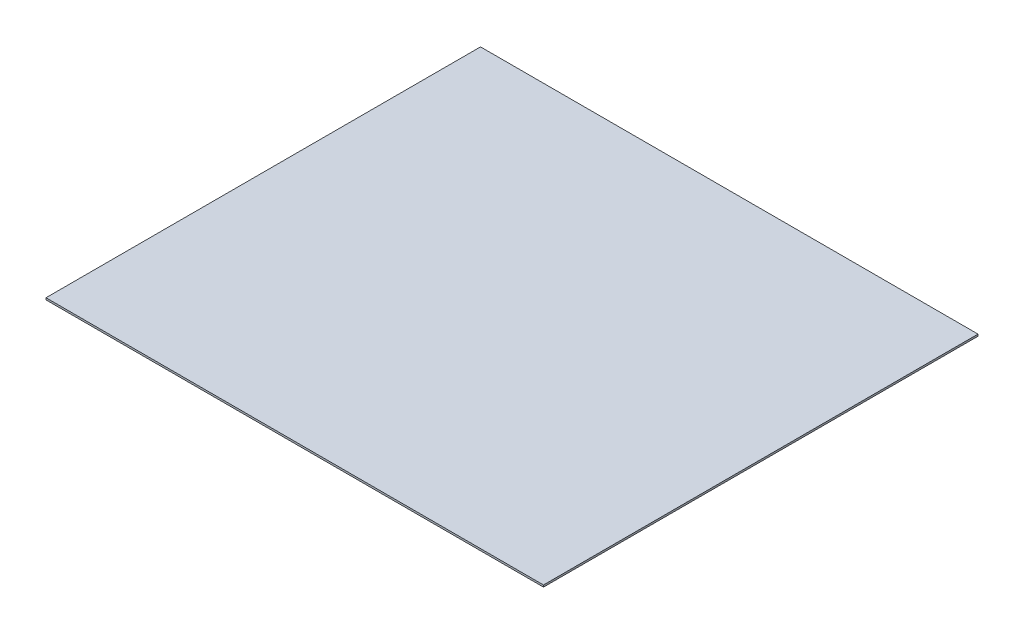
from build123d import *

# Parameters (mm, degrees)
SKETCH1_W           = 790
SKETCH1_H           = 690
BOSS_EXTRUDE1_DEPTH = 3


with BuildPart() as part:
    # Sketch1 → Boss-Extrude1 (new body)
    with BuildSketch(Plane(origin=(0, 0, 0), x_dir=(1, 0, 0), z_dir=(0, 1, 0))):
        Rectangle(SKETCH1_W, SKETCH1_H)
    extrude(amount=BOSS_EXTRUDE1_DEPTH)


solid = part.part
